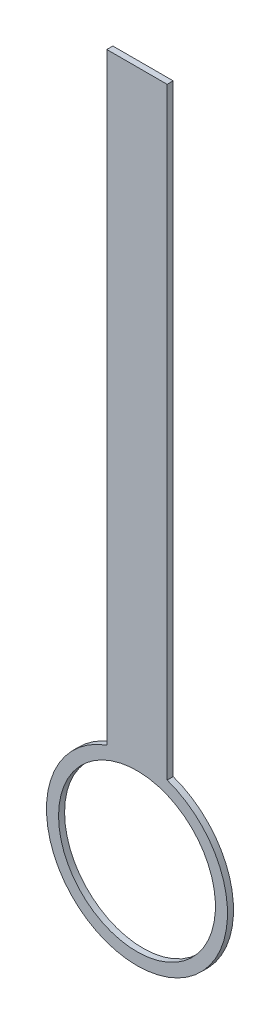
from build123d import *

# Parameters (mm, degrees)
SKETCH1_W           = 20000
SKETCH1_H           = 200000
BOSS_EXTRUDE1_DEPTH = 2000
SKETCH3_R           = 30000
SKETCH3_R_2         = 26000
BOSS_EXTRUDE3_DEPTH = 2000


with BuildPart() as part:
    # Sketch1 → Boss-Extrude1 (new body)
    with BuildSketch(Plane.XY):
        with Locations((10000, 100000)):
            Rectangle(SKETCH1_W, SKETCH1_H)
    extrude(amount=BOSS_EXTRUDE1_DEPTH)

    # Sketch3 → Boss-Extrude3 (add)
    with BuildSketch(Plane(origin=(0, 0, 0), x_dir=(-1, 0, 0), z_dir=(0, 0, -1))):
        with Locations((-10000, -28000)):
            Circle(SKETCH3_R)
        with Locations((-10000, -28000)):
            Circle(SKETCH3_R_2, mode=Mode.SUBTRACT)
    extrude(amount=-BOSS_EXTRUDE3_DEPTH)


solid = part.part
